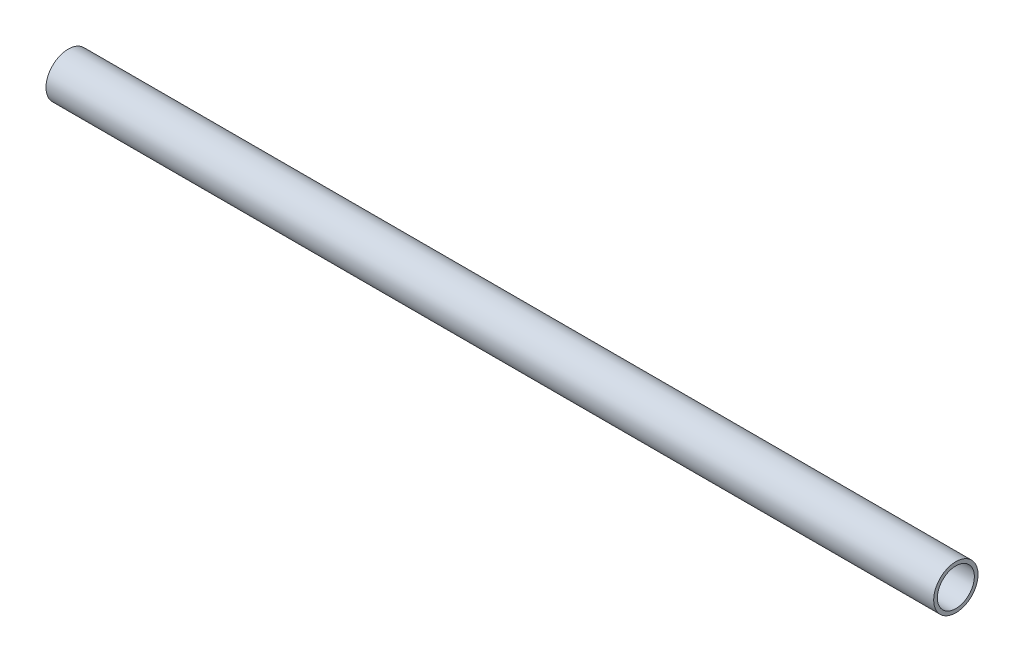
from build123d import *

# Parameters (mm, degrees)
SKETCH1_W = 120
SKETCH1_H = 0.5


with BuildPart() as part:
    # Sketch1 → Revolve1 (revolve)
    with BuildSketch(Plane(origin=(0, 0, 0), x_dir=(1, 0, 0), z_dir=(0, 1, 0)), mode=Mode.PRIVATE) as revolve1_sk:
        with Locations((60, 2.75)):
            Rectangle(SKETCH1_W, SKETCH1_H)
    revolve(revolve1_sk.sketch.rotate(Axis((-0.956467941, 0, 0), (1, 0, 0)), 180), axis=Axis((-0.956467941, 0, 0), (1, 0, 0)))


solid = part.part
